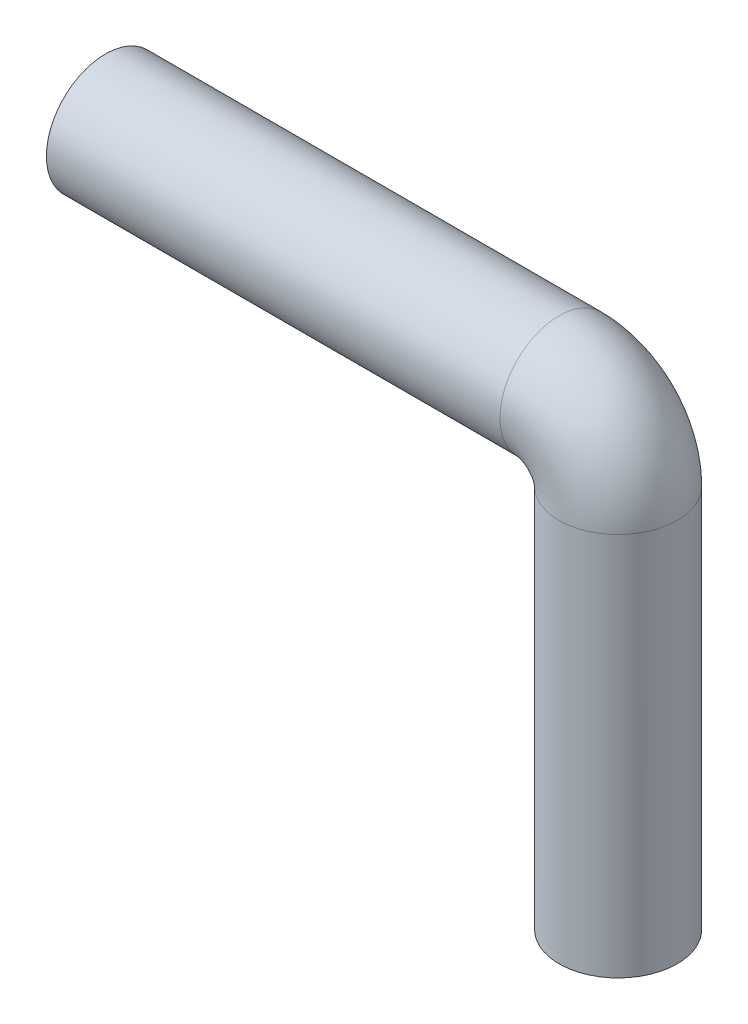
from build123d import *
from build123d.topology import SkipClean

# Parameters (mm, degrees)
SKETCH5_R           = 1.75
BOSS_EXTRUDE2_DEPTH = 1
BOSS_EXTRUDE3_START = 11.353238939
SKETCH6_R           = 1.75
BOSS_EXTRUDE3_DEPTH = 11.353238939
SKETCH7_R           = 2
BOSS_EXTRUDE4_REACH = 31.911
SKETCH9_R           = 2
BOSS_EXTRUDE5_START = -15.353238939
SKETCH10_R          = 2
BOSS_EXTRUDE5_DEPTH = 15.353238939


with BuildPart() as part:
    # Sketch1 → Revolve1 (revolve)
    with BuildSketch(Plane(origin=(0, 0, 0), x_dir=(-1, 0, 0), z_dir=(0, 0, -1)), mode=Mode.PRIVATE) as revolve1_sk:
        with BuildLine():
            Line((-11.972812665, -8.233263235), (-11.972812665, -7.983263235))
            Line((-11.972812665, -7.983263235), (-0.912123334, -7.983263235))
            Line((-0.912123334, -7.983263235), (-0.912123334, -6.533263235))
            Line((-0.912123334, -6.533263235), (-1.912123334, -6.533263235))
            Line((-1.912123334, -6.533263235), (-1.912123334, -6.783263235))
            Line((-1.912123334, -6.783263235), (-12.912123334, -6.783263235))
            ThreePointArc((-12.912123334, -6.783263235), (-13.230357031, -7.671229021), (-12.472812665, -8.233263235))
            Line((-12.472812665, -8.233263235), (-11.972812665, -8.233263235))
        make_face()
    revolve(revolve1_sk.sketch.rotate(Axis((12.175741694, -8.533263235, 0), (-1, 0, 0)), 270), axis=Axis((12.175741694, -8.533263235, 0), (-1, 0, 0)))

    # Sketch5 → Boss-Extrude2 (add, through all)
    with BuildSketch(Plane(origin=(1.912123334, 0, 0), x_dir=(0, 0, -1), z_dir=(1, 0, 0))):
        with Locations(Location((0, -8.533263235, 0), (0, 0, 180))):
            Circle(SKETCH5_R)
    extrude(amount=-BOSS_EXTRUDE2_DEPTH)

    # Sketch6 → Boss-Extrude3 (add)
    with BuildSketch(Plane(origin=(1.912123334, 0, 0), x_dir=(0, 0, -1), z_dir=(1, 0, 0)).offset(BOSS_EXTRUDE3_START)):
        with Locations((0, -8.533263235)):
            Circle(SKETCH6_R)
    extrude(amount=-BOSS_EXTRUDE3_DEPTH)

    # Sweep2: sweep along a path in Sketch8
    with BuildLine(Plane.XY) as sweep2_path:
        Line((13.265362274, -8.533263235), (16.265362274, -8.533263235))
        ThreePointArc((16.265362274, -8.533263235), (17.679575836, -9.119049673), (18.265362274, -10.533263235))
        Line((18.265362274, -10.533263235), (18.265362274, -23.533263235))
    # Sketch7 → Sweep2 (sweep)
    with BuildSketch(Plane(origin=(13.265362274, 0, 0), x_dir=(0, 0, -1), z_dir=(1, 0, 0))):
        with Locations((0, -8.533263235)):
            Circle(SKETCH7_R)
    sweep(path=sweep2_path.line)

    # Sketch9 → Boss-Extrude4 (add, up to next)
    with BuildSketch(Plane(origin=(1.912123334, 0, 0), x_dir=(0, 0, -1), z_dir=(1, 0, 0)), mode=Mode.PRIVATE) as boss_extrude4_sk1:
        with Locations(Location((0, -8.533263235, 0), (0, 0, 180))):
            Circle(SKETCH9_R)
    boss_extrude4_tool1 = extrude(boss_extrude4_sk1.sketch, amount=BOSS_EXTRUDE4_REACH, mode=Mode.PRIVATE) - part.part
    add(boss_extrude4_tool1.solids().sort_by_distance((1.912123, -8.533263, 0))[0])

    # Sketch10 → Boss-Extrude5 (add)
    with BuildSketch(Plane.ZY.offset(-0.912123334).offset(BOSS_EXTRUDE5_START)):
        with Locations((0, -8.533263235)):
            Circle(SKETCH10_R)
    extrude(amount=BOSS_EXTRUDE5_DEPTH)


solid = part.part
